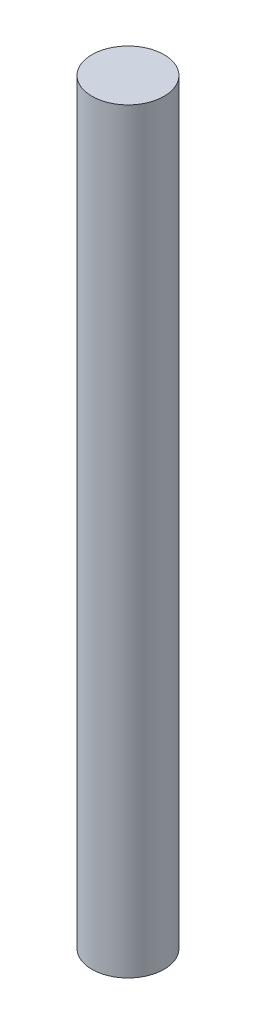
from build123d import *

# Parameters (mm, degrees)
SKETCH_1_R      = 16.7
EXTRUDE_1_DEPTH = 350


with BuildPart() as part:
    # Эскиз1 → Бобышка-Вытянуть1 (new body)
    with BuildSketch(Plane(origin=(0, 0, 0), x_dir=(1, 0, 0), z_dir=(0, 1, 0))):
        with Locations(Location((0, 0, 0), (0, 0, 270))):
            Circle(SKETCH_1_R)
    extrude(amount=EXTRUDE_1_DEPTH)


solid = part.part
